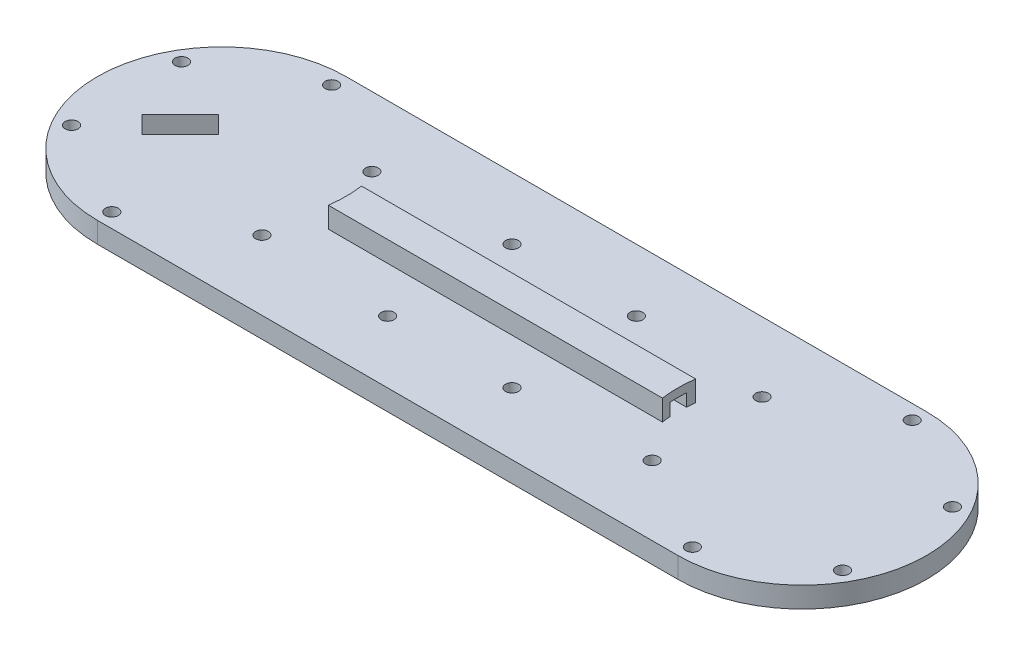
from build123d import *

# Parameters (mm, degrees)
SKETCH_1_R          = 1.55
EXTRUDE_2_DEPTH     = 5
SKETCH_2_R          = 1.55
CUT_EXTRUDE_2_DEPTH = 5
SKETCH_3_W          = 20
SKETCH_3_H          = 20
EXTRUDE_4_DEPTH     = 5
EXTRUDE_5_DEPTH     = 5
EXTRUDE_6_DEPTH     = 5
CUT_EXTRUDE_3_DEPTH = 150
SKETCH_8_W          = 8
SKETCH_8_H          = 5
CUT_EXTRUDE_4_DEPTH = 10
CUT_EXTRUDE_5_DEPTH = 10


with BuildPart() as part:
    # 草图1 → 凸台-拉伸2 (new body)
    with BuildSketch(Plane(origin=(0, 0, 0), x_dir=(1, 0, 0), z_dir=(0, 1, 0))):
        with BuildLine():
            Line((-70, 30), (70, 30))
            ThreePointArc((70, 30), (100, 0), (70, -30))
            Line((70, -30), (-70, -30))
            ThreePointArc((-70, -30), (-100, 0), (-70, 30))
        make_face()
        with Locations(Location((-15, 15, 0), (0, 0, 270))):
            Circle(SKETCH_1_R, mode=Mode.SUBTRACT)
        with Locations(Location((15, 15, 0), (0, 0, 270))):
            Circle(SKETCH_1_R, mode=Mode.SUBTRACT)
        with Locations(Location((15, -15, 0), (0, 0, 270))):
            Circle(SKETCH_1_R, mode=Mode.SUBTRACT)
        with Locations(Location((-15, -15, 0), (0, 0, 270))):
            Circle(SKETCH_1_R, mode=Mode.SUBTRACT)
        Polygon((-90, 0), (-90, 10), (-70, 10), (-70, -10), (-90, -10), align=None, mode=Mode.SUBTRACT)
        Polygon((90, 0), (90, 10), (70, 10), (70, -10), (90, -10), align=None, mode=Mode.SUBTRACT)
    extrude(amount=EXTRUDE_2_DEPTH)

    # 草图2 → 切除-拉伸2 (cut)
    with BuildSketch(Plane(origin=(0, 5, 0), x_dir=(1, 0, 0), z_dir=(0, 1, 0))):
        with Locations(Location((-70, 26.5, 0), (0, 0, 270))):
            Circle(SKETCH_2_R)
        with Locations(Location((-92.9496732, 13.25, 0), (0, 0, 270))):
            Circle(SKETCH_2_R)
        with Locations(Location((-92.9496732, -13.25, 0), (0, 0, 270))):
            Circle(SKETCH_2_R)
        with Locations(Location((-70, -26.5, 0), (0, 0, 270))):
            Circle(SKETCH_2_R)
        with Locations(Location((-47.0503268, -13.25, 0), (0, 0, 270))):
            Circle(SKETCH_2_R)
        with Locations(Location((-47.0503268, 13.25, 0), (0, 0, 270))):
            Circle(SKETCH_2_R)
        with Locations(Location((92.9496732, 13.25, 0), (0, 0, 270))):
            Circle(SKETCH_2_R)
        with Locations(Location((92.9496732, -13.25, 0), (0, 0, 270))):
            Circle(SKETCH_2_R)
        with Locations(Location((70, -26.5, 0), (0, 0, 270))):
            Circle(SKETCH_2_R)
        with Locations(Location((47.0503268, -13.25, 0), (0, 0, 270))):
            Circle(SKETCH_2_R)
        with Locations(Location((47.0503268, 13.25, 0), (0, 0, 270))):
            Circle(SKETCH_2_R)
        with Locations(Location((70, 26.5, 0), (0, 0, 270))):
            Circle(SKETCH_2_R)
    extrude(amount=-CUT_EXTRUDE_2_DEPTH, mode=Mode.SUBTRACT)

    # 草图3 → 凸台-拉伸4 (add)
    with BuildSketch(Plane(origin=(0, 5, 0), x_dir=(1, 0, 0), z_dir=(0, 1, 0))):
        with Locations((-80, 0)):
            Rectangle(SKETCH_3_W, SKETCH_3_H)
        with Locations((80, 0)):
            Rectangle(SKETCH_3_W, SKETCH_3_H)
    extrude(amount=-EXTRUDE_4_DEPTH)

    # 草图4 → 凸台-拉伸5 (add)
    with BuildSketch(Plane(origin=(0, 5, 0), x_dir=(1, 0, 0), z_dir=(0, 1, 0))):
        with BuildLine():
            Line((0, 4), (40.267862505, 4))
            ThreePointArc((40.267862505, 4), (40, 0), (40.267862505, -4))
            Line((40.267862505, -4), (0, -4))
            Line((0, -4), (-40.267862505, -4))
            ThreePointArc((-40.267862505, -4), (-40, 0), (-40.267862505, 4))
            Line((-40.267862505, 4), (0, 4))
        make_face()
    extrude(amount=EXTRUDE_5_DEPTH)

    # 草图6 → 凸台-拉伸6 (add)
    with BuildSketch(Plane(origin=(0, 5, 0), x_dir=(1, 0, 0), z_dir=(0, 1, 0))):
        Polygon((63.550267448, 4), (70, 4), (70, 0), (70, -4), (63.550267448, -4), align=None)
    extrude(amount=EXTRUDE_6_DEPTH)

    # 草图7 → 切除-拉伸3 (cut)
    with BuildSketch(Plane(origin=(70, 0, 0), x_dir=(0, 0, -1), z_dir=(1, 0, 0))):
        Polygon((2, 8), (0, 8), (-2, 8), (-2, 5), (0, 5), (2, 5), align=None)
    extrude(amount=-CUT_EXTRUDE_3_DEPTH, mode=Mode.SUBTRACT)

    # 草图8 → 切除-拉伸4 (cut)
    with BuildSketch(Plane(origin=(70, 0, 0), x_dir=(0, 0, -1), z_dir=(1, 0, 0))):
        with Locations((0, 7.5)):
            Rectangle(SKETCH_8_W, SKETCH_8_H)
    extrude(amount=-CUT_EXTRUDE_4_DEPTH, mode=Mode.SUBTRACT)

    # 草图9 → 切除-拉伸5 (cut)
    with BuildSketch(Plane.XZ):
        Polygon((-82.121320344, -2.121320344), (-86.717514421, 2.474873734), (-82.474873734, 6.717514421), (-77.878679656, 2.121320344), (-73.282485579, -2.474873734), (-77.525126266, -6.717514421), align=None)
    extrude(amount=-CUT_EXTRUDE_5_DEPTH, mode=Mode.SUBTRACT)


solid = part.part
